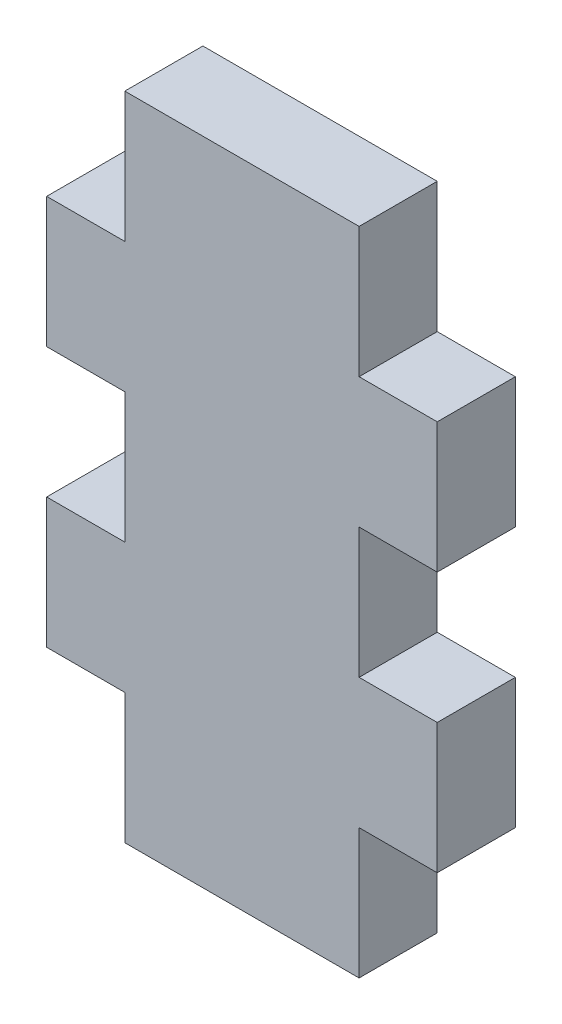
from build123d import *

# Parameters (mm, degrees)
SKETCH1_W           = 76.2
SKETCH1_H           = 127
BOSS_EXTRUDE1_DEPTH = 15.24
SKETCH13_W          = 15.24
SKETCH13_H          = 25.4
CUT_EXTRUDE1_DEPTH  = 15.24


with BuildPart() as part:
    # Sketch1 → Boss-Extrude1 (new body)
    with BuildSketch(Plane.XY):
        with Locations((38.1, 63.5)):
            Rectangle(SKETCH1_W, SKETCH1_H)
    extrude(amount=BOSS_EXTRUDE1_DEPTH)

    # Sketch13 → Cut-Extrude1 (cut)
    with BuildSketch(Plane.XY.offset(15.24)):
        with Locations((7.62, 114.3)):
            Rectangle(SKETCH13_W, SKETCH13_H)
        with Locations((7.62, 63.5)):
            Rectangle(SKETCH13_W, SKETCH13_H)
        with Locations((7.62, 12.7)):
            Rectangle(SKETCH13_W, SKETCH13_H)
        with Locations((68.58, 114.3)):
            Rectangle(SKETCH13_W, SKETCH13_H)
        with Locations((68.58, 63.5)):
            Rectangle(SKETCH13_W, SKETCH13_H)
        with Locations((68.58, 12.7)):
            Rectangle(SKETCH13_W, SKETCH13_H)
    extrude(amount=-CUT_EXTRUDE1_DEPTH, mode=Mode.SUBTRACT)


solid = part.part
